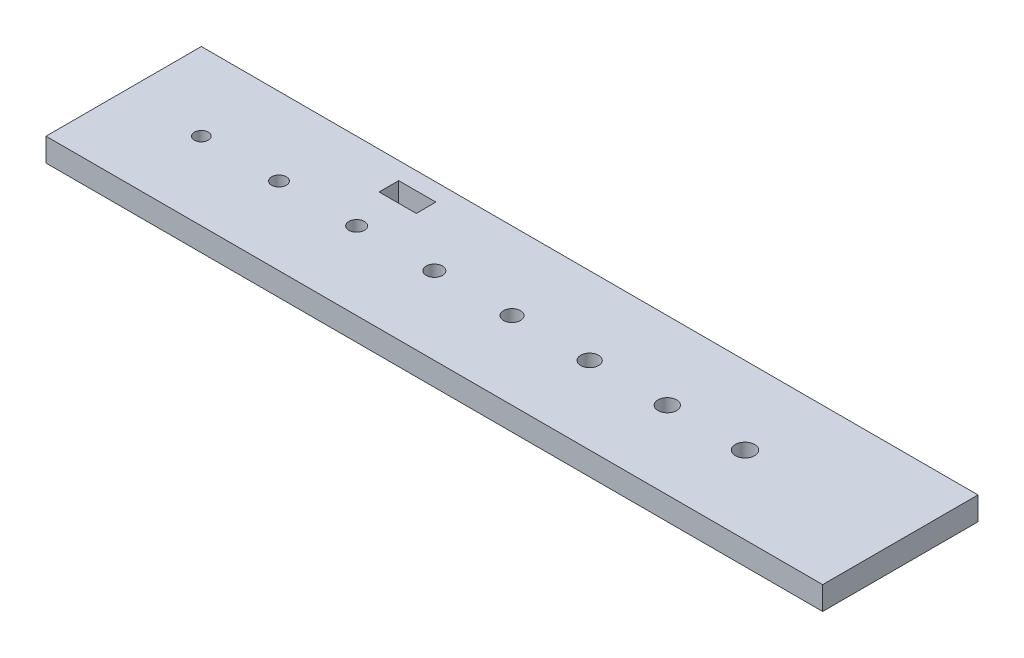
from build123d import *

# Parameters (mm, degrees)
SKETCH1_W           = 100
SKETCH1_H           = 20
BOSS_EXTRUDE1_DEPTH = 3
SKETCH2_W           = 4.785100676
SKETCH2_H           = 2.523053084
CUT_EXTRUDE1_DEPTH  = 3


with BuildPart() as part:
    # Sketch1 → Boss-Extrude1 (new body)
    with BuildSketch(Plane(origin=(0, 0, 0), x_dir=(1, 0, 0), z_dir=(0, 1, 0))):
        with Locations((50, -10)):
            Rectangle(SKETCH1_W, SKETCH1_H)
    extrude(amount=BOSS_EXTRUDE1_DEPTH)

    # Sketch2 → Cut-Extrude1 (cut)
    with BuildSketch(Plane(origin=(0, 3, 0), x_dir=(1, 0, 0), z_dir=(0, 1, 0))):
        with BuildLine():
            ThreePointArc((41.05, -10), (40, -8.95), (38.95, -10))
            Line((38.95, -10), (41.05, -10))
        make_face()
        with BuildLine():
            Line((41.05, -10), (38.95, -10))
            ThreePointArc((38.95, -10), (40, -11.05), (41.05, -10))
        make_face()
        with BuildLine():
            ThreePointArc((31, -10), (30, -9), (29, -10))
            Line((29, -10), (31, -10))
        make_face()
        with BuildLine():
            Line((31, -10), (29, -10))
            ThreePointArc((29, -10), (30, -11), (31, -10))
        make_face()
        with Locations((30.05546257, -3.512455318)):
            Rectangle(SKETCH2_W, SKETCH2_H)
        with BuildLine():
            ThreePointArc((20.95, -10), (20, -9.05), (19.05, -10))
            Line((19.05, -10), (20.95, -10))
        make_face()
        with BuildLine():
            Line((20.95, -10), (19.05, -10))
            ThreePointArc((19.05, -10), (20, -10.95), (20.95, -10))
        make_face()
        with BuildLine():
            ThreePointArc((71.2, -10), (70, -8.8), (68.8, -10))
            Line((68.8, -10), (71.2, -10))
        make_face()
        with BuildLine():
            Line((71.2, -10), (68.8, -10))
            ThreePointArc((68.8, -10), (70, -11.2), (71.2, -10))
        make_face()
        with BuildLine():
            ThreePointArc((81.25, -10), (80, -8.75), (78.75, -10))
            Line((78.75, -10), (81.25, -10))
        make_face()
        with BuildLine():
            Line((81.25, -10), (78.75, -10))
            ThreePointArc((78.75, -10), (80, -11.25), (81.25, -10))
        make_face()
        with BuildLine():
            ThreePointArc((51.1, -10), (50, -8.9), (48.9, -10))
            Line((48.9, -10), (51.1, -10))
        make_face()
        with BuildLine():
            Line((51.1, -10), (48.9, -10))
            ThreePointArc((48.9, -10), (50, -11.1), (51.1, -10))
        make_face()
        with BuildLine():
            ThreePointArc((10.9, -10), (10, -9.1), (9.1, -10))
            Line((9.1, -10), (10.9, -10))
        make_face()
        with BuildLine():
            Line((10.9, -10), (9.1, -10))
            ThreePointArc((9.1, -10), (10, -10.9), (10.9, -10))
        make_face()
        with BuildLine():
            ThreePointArc((61.15, -10), (60, -8.85), (58.85, -10))
            Line((58.85, -10), (61.15, -10))
        make_face()
        with BuildLine():
            Line((61.15, -10), (58.85, -10))
            ThreePointArc((58.85, -10), (60, -11.15), (61.15, -10))
        make_face()
    extrude(amount=-CUT_EXTRUDE1_DEPTH, mode=Mode.SUBTRACT)


solid = part.part
